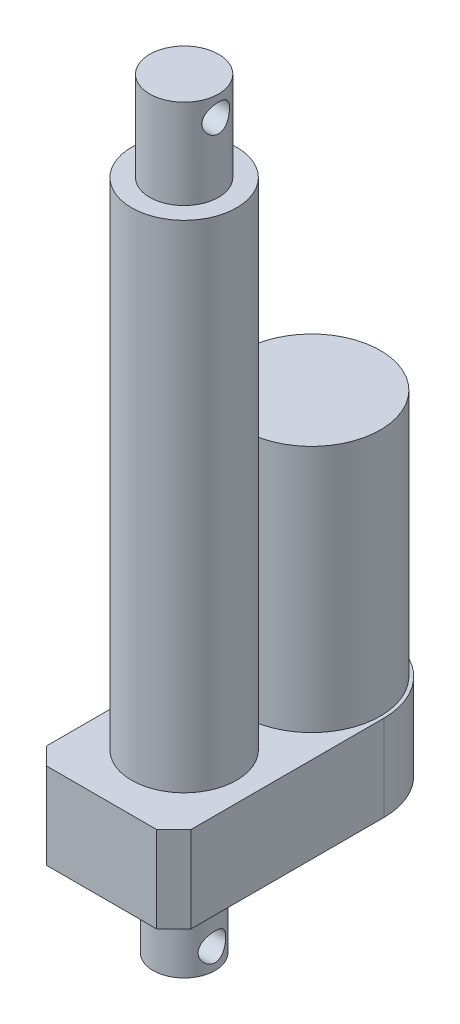
from build123d import *

# Parameters (mm, degrees)
BOSS_EXTRUDE1_DEPTH     = 25
SKETCH2_R               = 15.25
BOSS_EXTRUDE2_DEPTH     = 144
SKETCH3_R               = 20
BOSS_EXTRUDE3_DEPTH     = 72
SKETCH4_R               = 9
BOSS_EXTRUDE4_DEPTH     = 26
CUT_EXTRUDE1_DEPTH      = 180.905530765
CUT_EXTRUDE1_DEPTH_BACK = 180.905530765
SKETCH5_R               = 4
SKETCH6_R               = 10
BOSS_EXTRUDE5_DEPTH     = 26
CUT_EXTRUDE2_DEPTH      = 205.523837242
CUT_EXTRUDE2_DEPTH_BACK = 205.523837242
SKETCH7_R               = 4


with BuildPart() as part:
    # Sketch1 → Boss-Extrude1 (new body)
    with BuildSketch(Plane(origin=(0, 0, 0), x_dir=(1, 0, 0), z_dir=(0, 1, 0))):
        with BuildLine():
            Line((-16, -24), (16, -24))
            Line((16, -24), (21, -19))
            Line((21, -19), (21, 37))
            ThreePointArc((21, 37), (0, 58), (-21, 37))
            Line((-21, 37), (-21, -19))
            Line((-21, -19), (-16, -24))
        make_face()
    extrude(amount=BOSS_EXTRUDE1_DEPTH)

    # Sketch2 → Boss-Extrude2 (add)
    with BuildSketch(Plane(origin=(0, 25, 0), x_dir=(1, 0, 0), z_dir=(0, 1, 0))):
        with Locations(Location((0, 0, 0), (0, 0, 270))):
            Circle(SKETCH2_R)
    extrude(amount=BOSS_EXTRUDE2_DEPTH)

    # Sketch3 → Boss-Extrude3 (add)
    with BuildSketch(Plane(origin=(0, 25, 0), x_dir=(1, 0, 0), z_dir=(0, 1, 0))):
        with Locations(Location((0, 37, 0), (0, 0, 270))):
            Circle(SKETCH3_R)
    extrude(amount=BOSS_EXTRUDE3_DEPTH)

    # Sketch4 → Boss-Extrude4 (add)
    with BuildSketch(Plane.XZ):
        with Locations(Location((0, 0, 0), (0, 0, 90))):
            Circle(SKETCH4_R)
    extrude(amount=BOSS_EXTRUDE4_DEPTH)

    # Sketch5 → Cut-Extrude1 (cut, two sides: drawn at the far end of the back side and taken through both)
    with BuildSketch(Plane(origin=(0, 0, 0), x_dir=(0, 0, -1), z_dir=(1, 0, 0)).offset(-CUT_EXTRUDE1_DEPTH_BACK)):
        with Locations((0, -20)):
            Circle(SKETCH5_R)
    extrude(amount=CUT_EXTRUDE1_DEPTH + CUT_EXTRUDE1_DEPTH_BACK, mode=Mode.SUBTRACT)

    # Sketch6 → Boss-Extrude5 (add)
    with BuildSketch(Plane(origin=(0, 169, 0), x_dir=(1, 0, 0), z_dir=(0, 1, 0))):
        with Locations(Location((0, 0, 0), (0, 0, 90))):
            Circle(SKETCH6_R)
    extrude(amount=BOSS_EXTRUDE5_DEPTH)

    # Sketch7 → Cut-Extrude2 (cut, two sides: drawn at the far end of the back side and taken through both)
    with BuildSketch(Plane(origin=(0, 0, 0), x_dir=(0, 0, -1), z_dir=(1, 0, 0)).offset(-CUT_EXTRUDE2_DEPTH_BACK)):
        with Locations((0, 189)):
            Circle(SKETCH7_R)
    extrude(amount=CUT_EXTRUDE2_DEPTH + CUT_EXTRUDE2_DEPTH_BACK, mode=Mode.SUBTRACT)


solid = part.part
